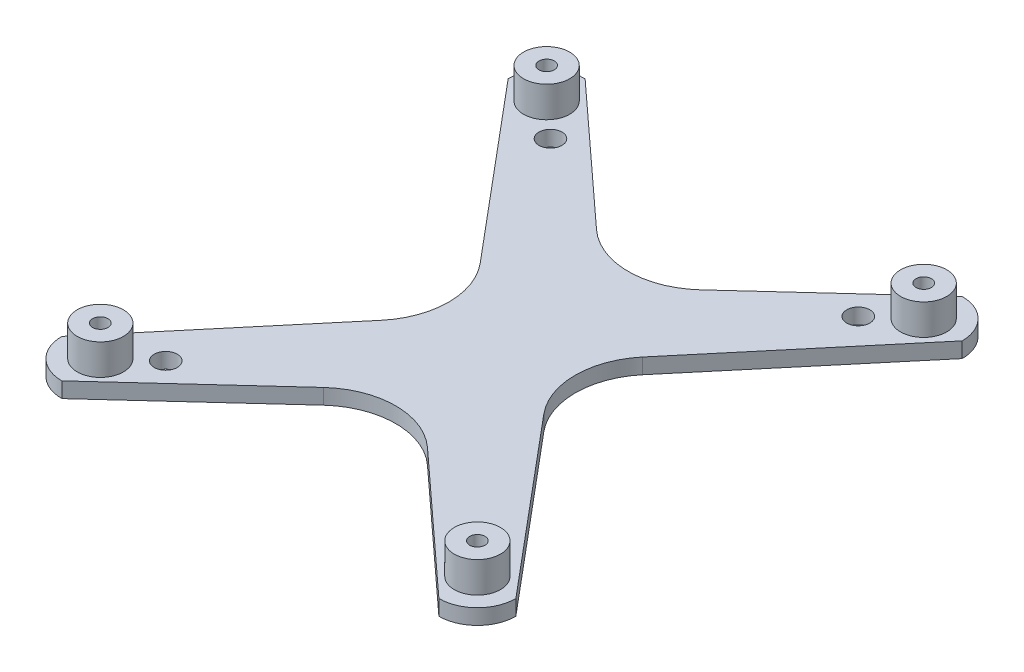
from build123d import *

# Parameters (mm, degrees)
SKETCH1_W           = 59
SKETCH1_H           = 68
SKETCH1_R           = 1
SKETCH1_R_2         = 1.5
BOSS_EXTRUDE1_DEPTH = 2
FILLET1_R           = 5
CUT_EXTRUDE1_DEPTH  = 2
SKETCH3_R           = 3
SKETCH3_R_2         = 1
BOSS_EXTRUDE2_DEPTH = 4


with BuildPart() as part:
    # Sketch1 → Boss-Extrude1 (new body)
    with BuildSketch(Plane(origin=(0, 0, 0), x_dir=(1, 0, 0), z_dir=(0, 1, 0))):
        with Locations((29.5, 34)):
            Rectangle(SKETCH1_W, SKETCH1_H)
        with Locations(Location((5, 5, 0), (0, 0, 270))):
            Circle(SKETCH1_R, mode=Mode.SUBTRACT)
        with Locations(Location((54, 5, 0), (0, 0, 270))):
            Circle(SKETCH1_R, mode=Mode.SUBTRACT)
        with Locations(Location((5, 63, 0), (0, 0, 270))):
            Circle(SKETCH1_R, mode=Mode.SUBTRACT)
        with Locations(Location((54, 63, 0), (0, 0, 270))):
            Circle(SKETCH1_R, mode=Mode.SUBTRACT)
        with Locations(Location((9.5, 59, 0), (0, 0, 270))):
            Circle(SKETCH1_R_2, mode=Mode.SUBTRACT)
        with Locations(Location((49.5, 59, 0), (0, 0, 270))):
            Circle(SKETCH1_R_2, mode=Mode.SUBTRACT)
        with Locations(Location((49.5, 9, 0), (0, 0, 270))):
            Circle(SKETCH1_R_2, mode=Mode.SUBTRACT)
        with Locations(Location((9.5, 9, 0), (0, 0, 270))):
            Circle(SKETCH1_R_2, mode=Mode.SUBTRACT)
    extrude(amount=BOSS_EXTRUDE1_DEPTH)

    # Fillet1
    fillet1_edges = [part.edges().sort_by_distance(p)[0] for p in [
        (0, 1, -68),
        (59, 1, -68),
        (59, 1, 0),
        (0, 1, 0),
    ]]
    fillet(fillet1_edges, radius=FILLET1_R)

    # Sketch2 → Cut-Extrude1 (cut)
    with BuildSketch(Plane(origin=(0, 2, 0), x_dir=(1, 0, 0), z_dir=(0, 1, 0))):
        with BuildLine():
            Line((0, 5), (18.940260842, 27.572123903))
            ThreePointArc((18.940260842, 27.572123903), (21.279816411, 34), (18.940260842, 40.427876097))
            Line((18.940260842, 40.427876097), (0, 63))
            Line((0, 63), (0, 5))
        make_face()
        with BuildLine():
            Line((54, 0), (36.255902076, 16.259470082))
            ThreePointArc((36.255902076, 16.259470082), (29.5, 18.886696714), (22.744097924, 16.259470082))
            Line((22.744097924, 16.259470082), (5, 0))
            Line((5, 0), (54, 0))
        make_face()
        with BuildLine():
            Line((54, 68), (5, 68))
            Line((5, 68), (22.744097924, 51.740529918))
            ThreePointArc((22.744097924, 51.740529918), (29.5, 49.113303286), (36.255902076, 51.740529918))
            Line((36.255902076, 51.740529918), (54, 68))
        make_face()
        with BuildLine():
            Line((59, 5), (59, 63))
            Line((59, 63), (40.059739158, 40.427876097))
            ThreePointArc((40.059739158, 40.427876097), (37.720183589, 34), (40.059739158, 27.572123903))
            Line((40.059739158, 27.572123903), (59, 5))
        make_face()
    extrude(amount=-CUT_EXTRUDE1_DEPTH, mode=Mode.SUBTRACT)

    # Sketch3 → Boss-Extrude2 (add)
    # profile 1 of 4: a face of its own
    with BuildSketch(Plane(origin=(0, 2, 0), x_dir=(1, 0, 0), z_dir=(0, 1, 0))):
        with Locations(Location((5, 63, 0), (0, 0, 270))):
            Circle(SKETCH3_R)
        with Locations(Location((5, 63, 0), (0, 0, 270))):
            Circle(SKETCH3_R_2, mode=Mode.SUBTRACT)
    # profile 2 of 4: a face of its own
    with BuildSketch(Plane(origin=(0, 2, 0), x_dir=(1, 0, 0), z_dir=(0, 1, 0))):
        with Locations(Location((54, 63, 0), (0, 0, 90))):
            Circle(SKETCH3_R)
        with Locations(Location((54, 63, 0), (0, 0, 270))):
            Circle(SKETCH3_R_2, mode=Mode.SUBTRACT)
    # profile 3 of 4: a face of its own
    with BuildSketch(Plane(origin=(0, 2, 0), x_dir=(1, 0, 0), z_dir=(0, 1, 0))):
        with Locations(Location((54, 5, 0), (0, 0, 90))):
            Circle(SKETCH3_R)
        with Locations(Location((54, 5, 0), (0, 0, 270))):
            Circle(SKETCH3_R_2, mode=Mode.SUBTRACT)
    # profile 4 of 4: a face of its own
    with BuildSketch(Plane(origin=(0, 2, 0), x_dir=(1, 0, 0), z_dir=(0, 1, 0))):
        with Locations(Location((5, 5, 0), (0, 0, 90))):
            Circle(SKETCH3_R)
        with Locations(Location((5, 5, 0), (0, 0, 270))):
            Circle(SKETCH3_R_2, mode=Mode.SUBTRACT)
    extrude(amount=BOSS_EXTRUDE2_DEPTH)


solid = part.part
